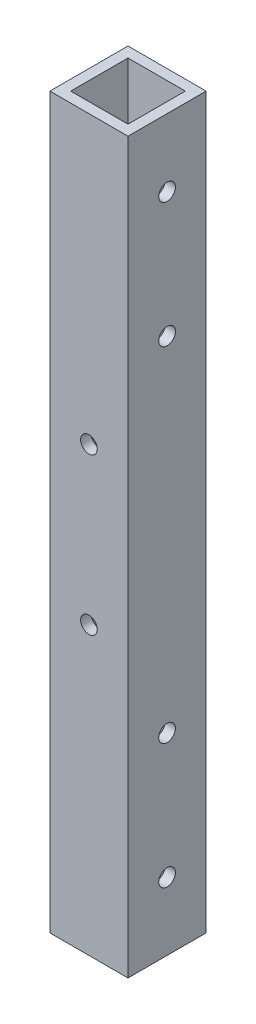
from build123d import *

# Parameters (mm, degrees)
SKETCH1_W           = 15
SKETCH1_H           = 15
SKETCH1_W_2         = 11
SKETCH1_H_2         = 11
BOSS_EXTRUDE1_DEPTH = 140
SKETCH2_R           = 1.6
CUT_EXTRUDE1_DEPTH  = 142.598022585
SKETCH3_R           = 1.6
CUT_EXTRUDE2_DEPTH  = 142.598022585


with BuildPart() as part:
    # Sketch1 → Boss-Extrude1 (new body)
    with BuildSketch(Plane(origin=(0, 0, 0), x_dir=(1, 0, 0), z_dir=(0, 1, 0))):
        with Locations((7.5, 7.5)):
            Rectangle(SKETCH1_W, SKETCH1_H)
        with Locations((7.5, 7.5)):
            Rectangle(SKETCH1_W_2, SKETCH1_H_2, mode=Mode.SUBTRACT)
    extrude(amount=BOSS_EXTRUDE1_DEPTH)

    # Sketch2 → Cut-Extrude1 (cut, through all)
    with BuildSketch(Plane(origin=(15, 0, 0), x_dir=(0, 0, -1), z_dir=(1, 0, 0))):
        with Locations((7.5, 13)):
            Circle(SKETCH2_R)
        with Locations((7.5, 37)):
            Circle(SKETCH2_R)
        with Locations((7.5, 103)):
            Circle(SKETCH2_R)
        with Locations((7.5, 127)):
            Circle(SKETCH2_R)
    extrude(amount=-CUT_EXTRUDE1_DEPTH, mode=Mode.SUBTRACT)

    # Sketch3 → Cut-Extrude2 (cut, through all)
    with BuildSketch(Plane.XY):
        with Locations((7.5, 85)):
            Circle(SKETCH3_R)
        with Locations((7.5, 55)):
            Circle(SKETCH3_R)
    extrude(amount=-CUT_EXTRUDE2_DEPTH, mode=Mode.SUBTRACT)


solid = part.part
